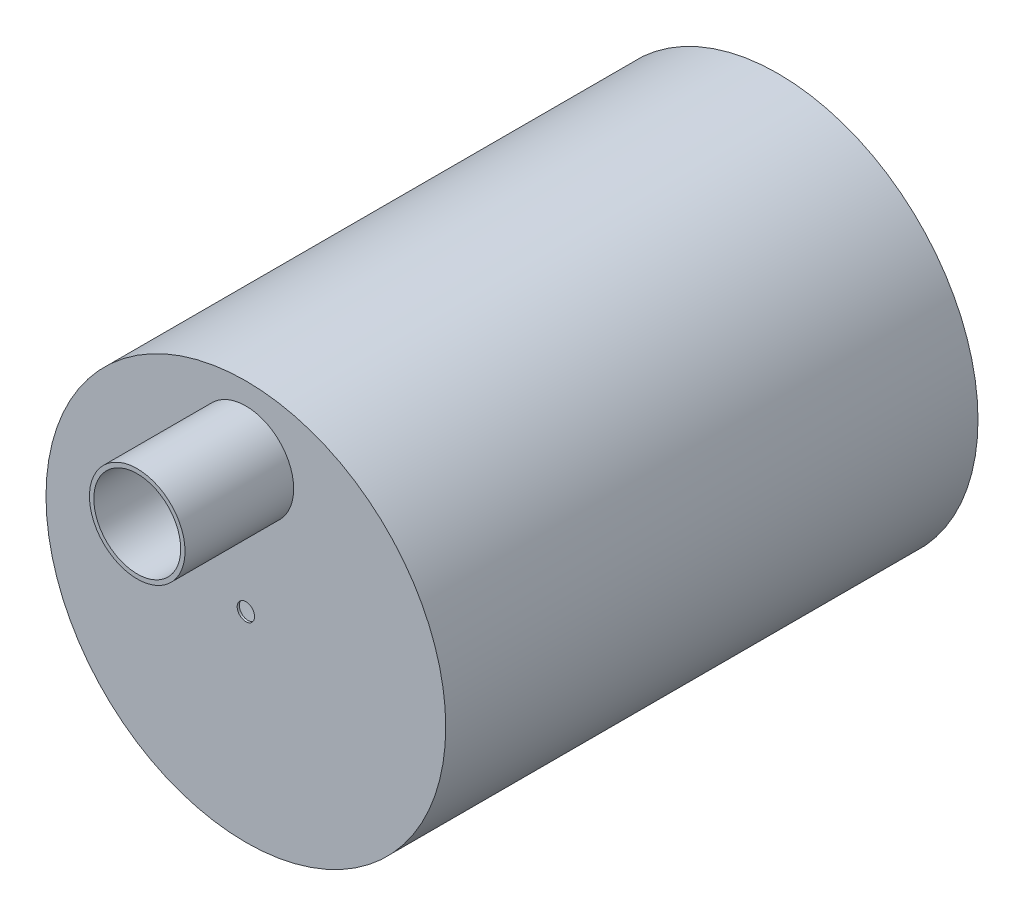
from build123d import *

# Parameters (mm, degrees)
SKETCH1_R           = 92
SKETCH1_R_2         = 90
BOSS_EXTRUDE1_DEPTH = 245
BOSS_EXTRUDE2_START = -1
SKETCH2_R           = 90
SKETCH2_R_2         = 4
SKETCH2_R_3         = 20
BOSS_EXTRUDE2_DEPTH = 1
SKETCH3_R           = 22
SKETCH3_R_2         = 20
BOSS_EXTRUDE3_DEPTH = 50


with BuildPart() as part:
    # Sketch1 → Boss-Extrude1 (new body)
    with BuildSketch(Plane.XY):
        Circle(SKETCH1_R)
        Circle(SKETCH1_R_2, mode=Mode.SUBTRACT)
    extrude(amount=BOSS_EXTRUDE1_DEPTH)

    # Sketch2 → Boss-Extrude2 (add)
    with BuildSketch(Plane.XY.offset(245).offset(BOSS_EXTRUDE2_START)):
        Circle(SKETCH2_R)
        Circle(SKETCH2_R_2, mode=Mode.SUBTRACT)
        with Locations((0, 60)):
            Circle(SKETCH2_R_3, mode=Mode.SUBTRACT)
    extrude(amount=BOSS_EXTRUDE2_DEPTH)


with BuildPart() as body_2:
    # Sketch3 → Boss-Extrude3 (new body)
    with BuildSketch(Plane.XY.offset(245)):
        with Locations((0, 60)):
            Circle(SKETCH3_R)
        with Locations((0, 60)):
            Circle(SKETCH3_R_2, mode=Mode.SUBTRACT)
    extrude(amount=BOSS_EXTRUDE3_DEPTH)


solid = Compound([part.part, body_2.part])
